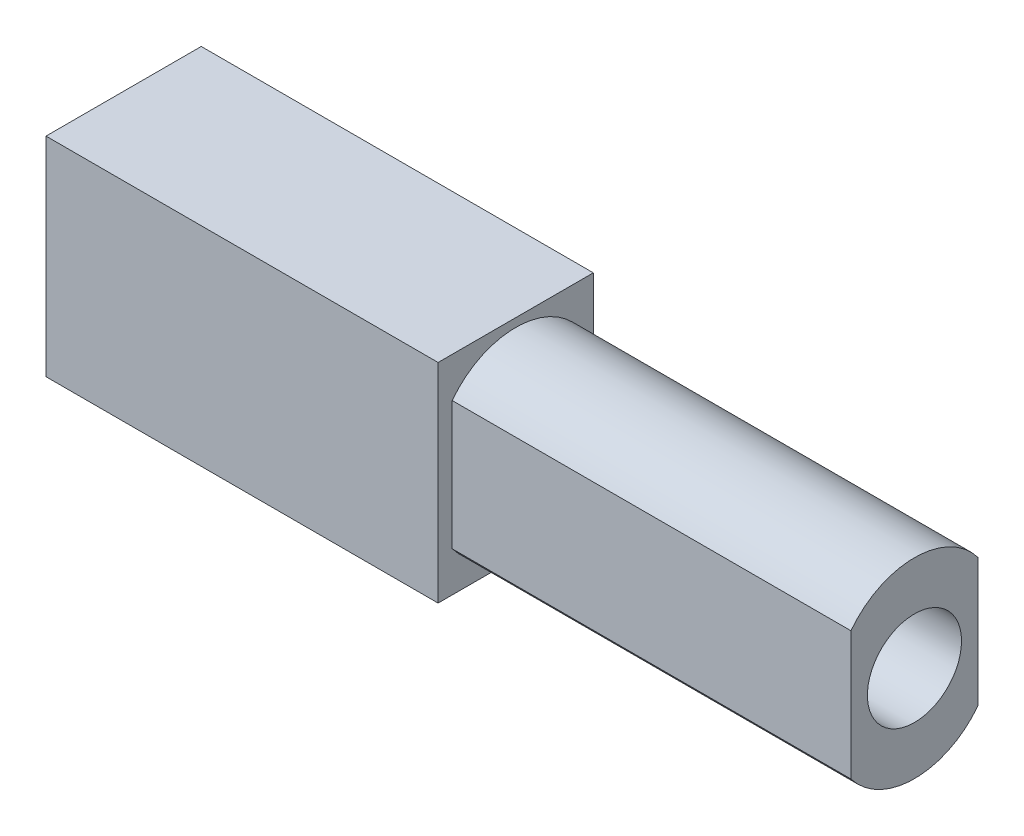
from build123d import *

# Parameters (mm, degrees)
BOSS_EXTRUDE1_DEPTH = 38.1
SKETCH2_R           = 4.4958
CUT_EXTRUDE1_DEPTH  = 25.4
SKETCH4_W           = 14.8336
SKETCH4_H           = 19.9136
BOSS_EXTRUDE2_DEPTH = 37.465


with BuildPart() as part:
    # Sketch1 → Boss-Extrude1 (new body)
    with BuildSketch(Plane(origin=(0, 0, 0), x_dir=(0, 0, -1), z_dir=(1, 0, 0))):
        with BuildLine():
            Line((-6.0706, 6.1341), (-6.0706, -6.1341))
            ThreePointArc((-6.0706, -6.1341), (0, -9.148427884), (6.0706, -6.1341))
            Line((6.0706, -6.1341), (6.0706, 6.1341))
            ThreePointArc((6.0706, 6.1341), (0, 9.148427884), (-6.0706, 6.1341))
        make_face()
    extrude(amount=BOSS_EXTRUDE1_DEPTH)

    # Sketch2 → Cut-Extrude1 (cut)
    with BuildSketch(Plane(origin=(38.1, 0, 0), x_dir=(0, 0, -1), z_dir=(1, 0, 0))):
        Circle(SKETCH2_R)
    extrude(amount=-CUT_EXTRUDE1_DEPTH, mode=Mode.SUBTRACT)

    # Sketch4 → Boss-Extrude2 (add)
    with BuildSketch(Plane.ZY):
        Rectangle(SKETCH4_W, SKETCH4_H)
    extrude(amount=BOSS_EXTRUDE2_DEPTH)


solid = part.part
